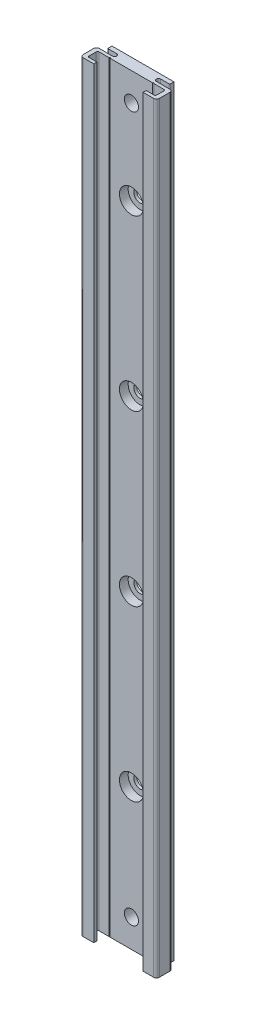
from build123d import *

# Parameters (mm, degrees)
BOSS_EXTRUDE1_DEPTH                              = 270
CUT_EXTRUDE1_DEPTH                               = 271.477244884
F_0_4_0_4_DIAMETER_HOLE1_D                       = 0.4
CBORE_FOR_M4_HEX_HEAD_MACHINE_SCREW1_D           = 4.5
CBORE_FOR_M4_HEX_HEAD_MACHINE_SCREW1_DEPTH       = 4.1
CBORE_FOR_M4_HEX_HEAD_MACHINE_SCREW1_CBORE_D     = 8.5
CBORE_FOR_M4_HEX_HEAD_MACHINE_SCREW1_CBORE_DEPTH = 3.1
FILLET1_R                                        = 0.2
FILLET2_R                                        = 0.5
FILLET3_R                                        = 1
CUT_EXTRUDE2_REACH                               = 302.339
SKETCH7_R                                        = 2.5


with BuildPart() as part:
    # Sketch1 → Boss-Extrude1 (new body)
    with BuildSketch(Plane(origin=(0, 300, 0), x_dir=(1, 0, 0), z_dir=(0, 1, 0))):
        with BuildLine():
            Line((-13.5, -3), (-13.5, -8.7))
            Line((-13.5, -8.7), (13.5, -8.7))
            Line((13.5, -8.7), (13.5, -3))
            Line((13.5, -3), (7.8, -3))
            ThreePointArc((7.8, -3), (7.05, -2.25), (7.8, -1.5))
            Line((7.8, -1.5), (11, -1.5))
            Line((11, -1.5), (11, 0))
            Line((11, 0), (-11, 0))
            Line((-11, 0), (-11, -1.5))
            Line((-11, -1.5), (-7.8, -1.5))
            ThreePointArc((-7.8, -1.5), (-7.05, -2.25), (-7.8, -3))
            Line((-7.8, -3), (-13.5, -3))
        make_face()
    extrude(amount=-BOSS_EXTRUDE1_DEPTH)

    # Sketch2 → Cut-Extrude1 (cut, through all)
    with BuildSketch(Plane.XZ.offset(-30)):
        Polygon((8.75, 8.7), (-8.75, 8.7), (-8.75, 7.6), (-12, 7.6), (-12, 4.1), (12, 4.1), (12, 7.6), (8.75, 7.6), align=None)
    extrude(amount=-CUT_EXTRUDE1_DEPTH, mode=Mode.SUBTRACT)

    # Ø0.4 (0.4) Diameter Hole1 (through all)
    with Locations(Plane(origin=(0, 300, 0), x_dir=(1, 0, 0), z_dir=(0, 1, 0))):
        with Locations((-7.75, -4.1), (7.75, -4.1)):
            Hole(F_0_4_0_4_DIAMETER_HOLE1_D / 2)

    # CBORE for M4 Hex Head Machine Screw1
    with Locations(Plane.XY.offset(4.1)):
        with Locations((0, 260), (0, 200), (0, 140), (0, 80), (0, 20)):
            CounterBoreHole(CBORE_FOR_M4_HEX_HEAD_MACHINE_SCREW1_D / 2, CBORE_FOR_M4_HEX_HEAD_MACHINE_SCREW1_CBORE_D / 2, CBORE_FOR_M4_HEX_HEAD_MACHINE_SCREW1_CBORE_DEPTH, depth=CBORE_FOR_M4_HEX_HEAD_MACHINE_SCREW1_DEPTH)

    # Fillet1
    fillet1_edges = [part.edges().sort_by_distance(p)[0] for p in [
        (-11, 165, 1.5),
        (11, 165, 1.5),
    ]]
    fillet(fillet1_edges, radius=FILLET1_R)

    # Fillet2
    fillet2_edges = [part.edges().sort_by_distance(p)[0] for p in [
        (12, 165, 7.6),
        (12, 165, 4.1),
        (-12, 165, 4.1),
        (-12, 165, 7.6),
    ]]
    fillet(fillet2_edges, radius=FILLET2_R)

    # Fillet3
    fillet3_edges = [part.edges().sort_by_distance(p)[0] for p in [
        (13.5, 165, 3),
        (13.5, 165, 8.7),
        (-13.5, 165, 8.7),
        (-13.5, 165, 3),
    ]]
    fillet(fillet3_edges, radius=FILLET3_R)

    # Sketch7 → Cut-Extrude2 (cut, up to next)
    with BuildSketch(Plane.XY.offset(4.1), mode=Mode.PRIVATE) as cut_extrude2_sk1:
        with Locations((0, 290)):
            Circle(SKETCH7_R)
    cut_extrude2_tool1 = extrude(cut_extrude2_sk1.sketch, amount=-CUT_EXTRUDE2_REACH, mode=Mode.PRIVATE) & part.part
    # Sketch7 → Cut-Extrude2 (cut, up to next)
    with BuildSketch(Plane.XY.offset(4.1), mode=Mode.PRIVATE) as cut_extrude2_sk2:
        with Locations((0, 40)):
            Circle(SKETCH7_R)
    cut_extrude2_tool2 = extrude(cut_extrude2_sk2.sketch, amount=-CUT_EXTRUDE2_REACH, mode=Mode.PRIVATE) & part.part
    add(cut_extrude2_tool1.solids().sort_by_distance((0, 290, 4.1))[0], mode=Mode.SUBTRACT)
    add(cut_extrude2_tool2.solids().sort_by_distance((0, 40, 4.1))[0], mode=Mode.SUBTRACT)


solid = part.part
